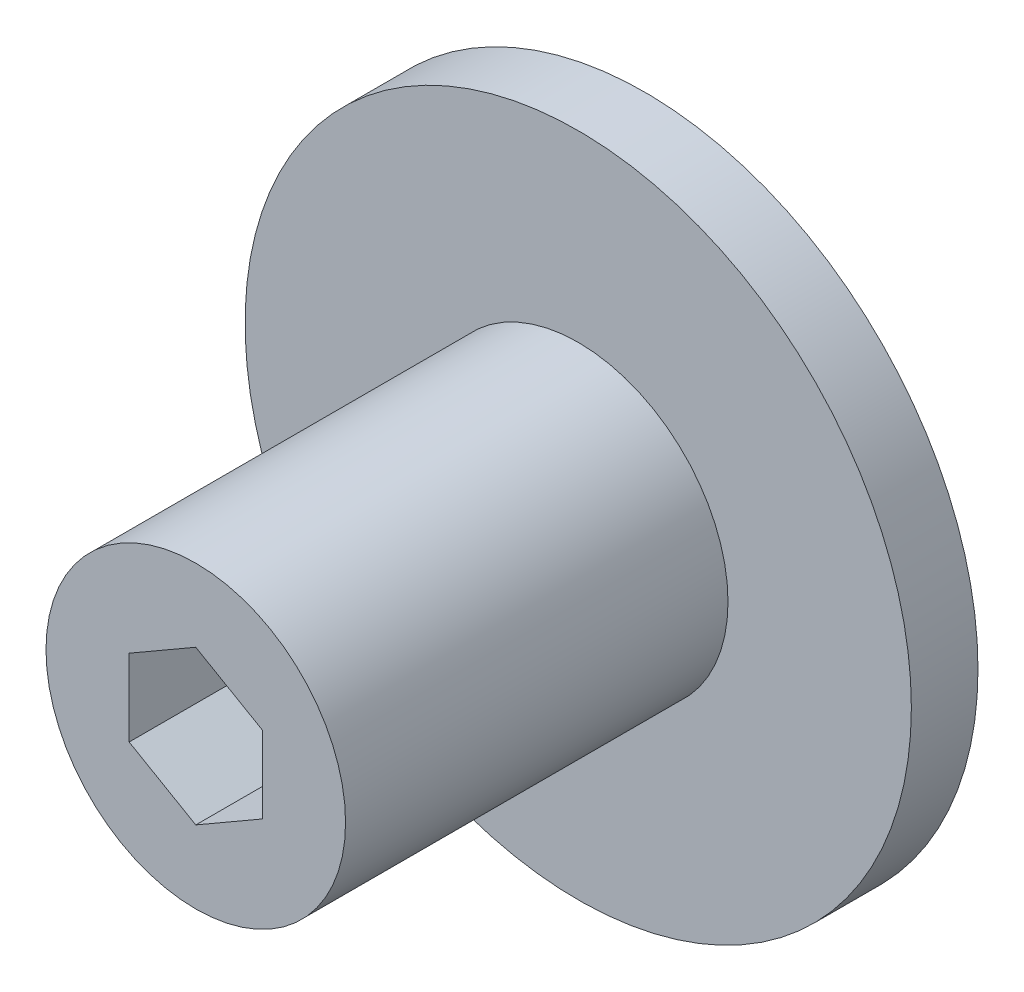
from build123d import *

# Parameters (mm, degrees)
SKETCH1_R           = 31.75
BOSS_EXTRUDE1_DEPTH = 3.175
SKETCH2_R           = 14.2748
BOSS_EXTRUDE2_DEPTH = 36.449
CUT_EXTRUDE1_DEPTH  = 25.4
CUT_EXTRUDE2_DEPTH  = 12.7


with BuildPart() as part:
    # Sketch1 → Boss-Extrude1 (new, symmetric)
    with BuildSketch(Plane.XY):
        Circle(SKETCH1_R)
    extrude(amount=BOSS_EXTRUDE1_DEPTH, both=True)

    # Sketch2 → Boss-Extrude2 (add)
    with BuildSketch(Plane.XY.offset(3.175)):
        Circle(SKETCH2_R)
    extrude(amount=BOSS_EXTRUDE2_DEPTH)

    # Sketch3 → Cut-Extrude1 (cut)
    with BuildSketch(Plane(origin=(0, 0, -3.175), x_dir=(-1, 0, 0), z_dir=(0, 0, -1))):
        with BuildLine():
            Line((-10.066701328, 1.984375), (-10.066701328, -1.984375))
            Line((-10.066701328, -1.984375), (-7.685451328, -1.984375))
            ThreePointArc((-7.685451328, -1.984375), (-6.874076643, -3.96875), (-5.561244824, -5.663608589))
            Line((-5.561244824, -5.663608589), (-6.751869824, -7.725831582))
            Line((-6.751869824, -7.725831582), (-3.314831503, -9.710206582))
            Line((-3.314831503, -9.710206582), (-2.124206503, -7.647983589))
            ThreePointArc((-2.124206503, -7.647983589), (0, -7.9375), (2.124206503, -7.647983589))
            Line((2.124206503, -7.647983589), (3.314831503, -9.710206582))
            Line((3.314831503, -9.710206582), (6.751869824, -7.725831582))
            Line((6.751869824, -7.725831582), (5.561244824, -5.663608589))
            ThreePointArc((5.561244824, -5.663608589), (6.874076643, -3.96875), (7.685451328, -1.984375))
            Line((7.685451328, -1.984375), (10.066701328, -1.984375))
            Line((10.066701328, -1.984375), (10.066701328, 1.984375))
            Line((10.066701328, 1.984375), (7.685451328, 1.984375))
            ThreePointArc((7.685451328, 1.984375), (6.874076643, 3.96875), (5.561244824, 5.663608589))
            Line((5.561244824, 5.663608589), (6.751869824, 7.725831582))
            Line((6.751869824, 7.725831582), (3.314831503, 9.710206582))
            Line((3.314831503, 9.710206582), (2.124206503, 7.647983589))
            ThreePointArc((2.124206503, 7.647983589), (0, 7.9375), (-2.124206503, 7.647983589))
            Line((-2.124206503, 7.647983589), (-3.314831503, 9.710206582))
            Line((-3.314831503, 9.710206582), (-6.751869824, 7.725831582))
            Line((-6.751869824, 7.725831582), (-5.561244824, 5.663608589))
            ThreePointArc((-5.561244824, 5.663608589), (-6.874076643, 3.96875), (-7.685451328, 1.984375))
            Line((-7.685451328, 1.984375), (-10.066701328, 1.984375))
        make_face()
    extrude(amount=-CUT_EXTRUDE1_DEPTH, mode=Mode.SUBTRACT)

    # Sketch4 → Cut-Extrude2 (cut)
    with BuildSketch(Plane.XY.offset(39.624)):
        Polygon((0, 7.332348419), (-6.35, 3.666174209), (-6.35, -3.666174209), (0, -7.332348419), (6.35, -3.666174209), (6.35, 3.666174209), align=None)
    extrude(amount=-CUT_EXTRUDE2_DEPTH, mode=Mode.SUBTRACT)


solid = part.part
